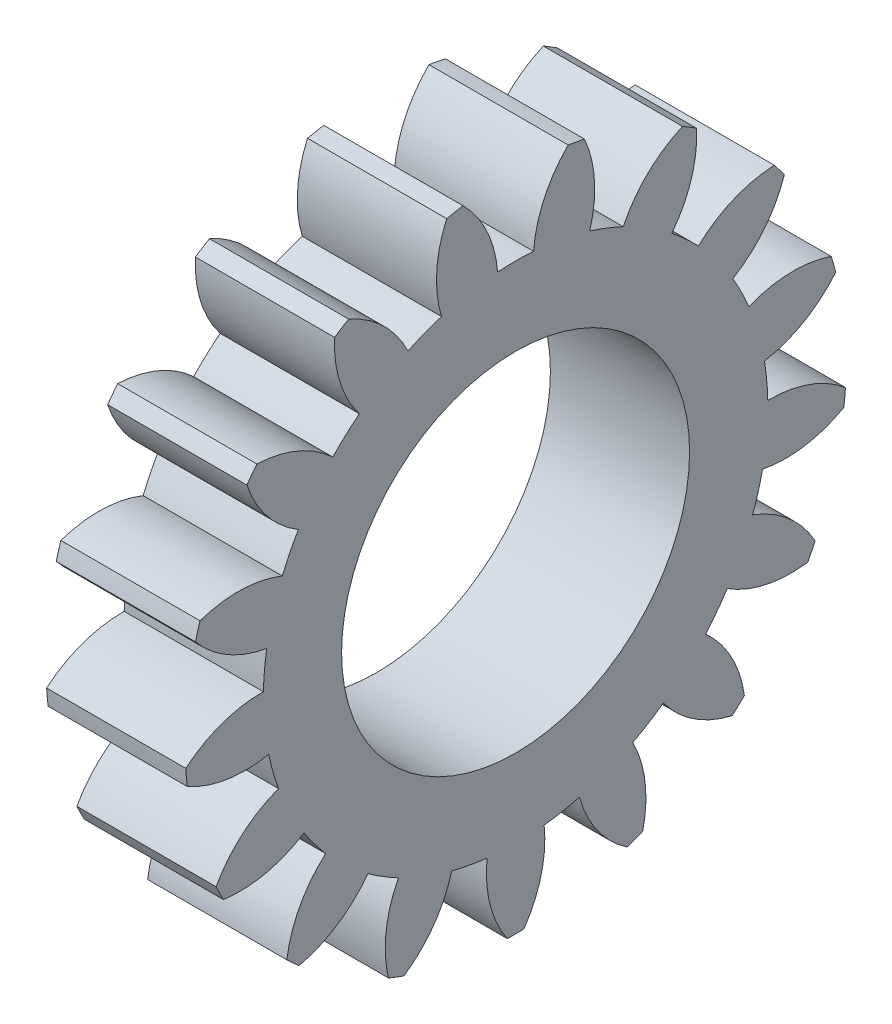
from build123d import *

# Parameters (mm, degrees)
BASPROSKE_W     = 4
BASPROSKE_H     = 9.5
TOOTHCUT_DEPTH  = 15.017845769
TEETHCUTS_COUNT = 17
TEETHCUTS_ANGLE = 338.823529412
BORSKE_R        = 5
BORE_DEPTH      = 50.0000508


with BuildPart() as part:
    # BasProSke → Base-Revolve (revolve)
    with BuildSketch(Plane(origin=(0, 0, 0), x_dir=(1, 0, 0), z_dir=(0, 1, 0)), mode=Mode.PRIVATE) as base_revolve_sk:
        with Locations((2, 4.75)):
            Rectangle(BASPROSKE_W, BASPROSKE_H)
    revolve(base_revolve_sk.sketch.rotate(Axis((-10, 0, 0), (1, 0, 0)), 180), axis=Axis((-10, 0, 0), (1, 0, 0)))

    # TooCutSke → ToothCut (cut, through all)
    with BuildSketch(Plane(origin=(0, 0, 0), x_dir=(0, 0, -1), z_dir=(1, 0, 0))):
        with BuildLine():
            ThreePointArc((0.516861231, 7.23055015), (0, 7.249), (-0.516861231, 7.23055015))
            ThreePointArc((-0.516861231, 7.23055015), (-0.827352654, 8.408398361), (-1.533069197, 9.401220346))
            ThreePointArc((-1.533069197, 9.401220346), (0, 9.5254), (1.533069197, 9.401220346))
            ThreePointArc((1.533069197, 9.401220346), (0.827352654, 8.408398361), (0.516861231, 7.23055015))
        make_face()
    toothcut = extrude(amount=TOOTHCUT_DEPTH, mode=Mode.SUBTRACT)

    # TeethCuts: ToothCut ×17 about axis
    teethcuts_axis = Axis((-10, 0, 0), (1, 0, 0))
    for i in range(1, TEETHCUTS_COUNT):
        add(toothcut.rotate(teethcuts_axis, i * TEETHCUTS_ANGLE / (TEETHCUTS_COUNT - 1)), mode=Mode.SUBTRACT)

    # BorSke → Bore (cut, symmetric)
    with BuildSketch(Plane(origin=(0, 0, 0), x_dir=(0, 0, -1), z_dir=(1, 0, 0))):
        with Locations(Location((0, 0, 0), (0, 0, 180))):
            Circle(BORSKE_R)
    extrude(amount=BORE_DEPTH, both=True, mode=Mode.SUBTRACT)


solid = part.part
